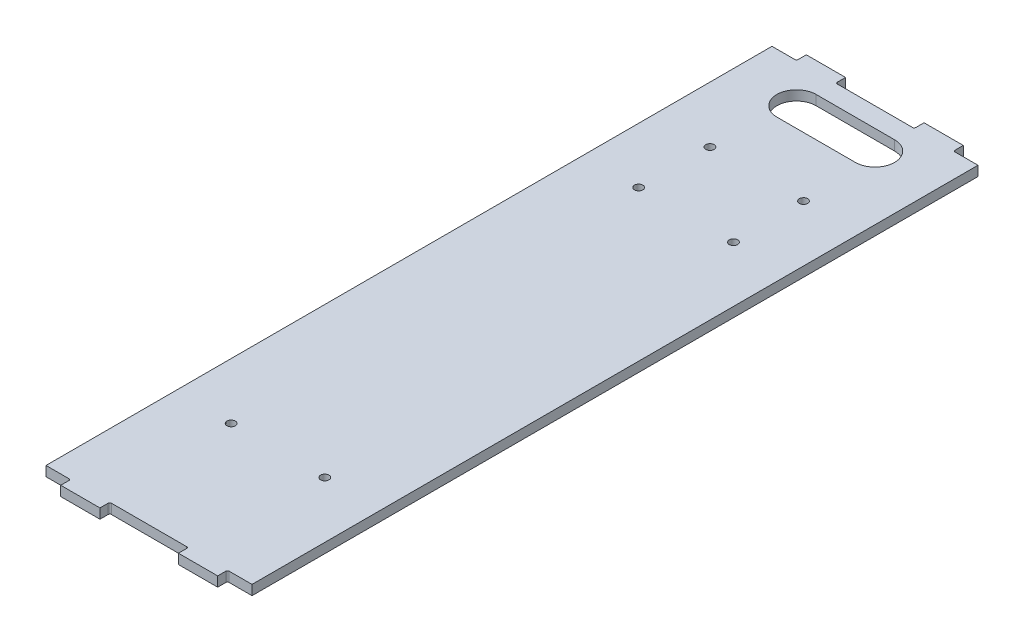
from build123d import *

# Parameters (mm, degrees)
SKETCH1_W             = 66.675
SKETCH1_H             = 234.95
BOSS_EXTRUDE1_DEPTH   = 3.175
SKETCH3_W             = 12.7
SKETCH3_H             = 3.175
BOSS_EXTRUDE2_DEPTH   = 3.175
CUT_EXTRUDE1_DEPTH    = 126.211389383
FILLET1_R             = 0.508
F_6_32_TAPPED_HOLE1_D = 2.7051


with BuildPart() as part:
    # Sketch1 → Boss-Extrude1 (new body)
    with BuildSketch(Plane(origin=(0, 0, 0), x_dir=(1, 0, 0), z_dir=(0, 1, 0))):
        Rectangle(SKETCH1_W, SKETCH1_H)
    extrude(amount=BOSS_EXTRUDE1_DEPTH)

    # Sketch3 → Boss-Extrude2 (add)
    with BuildSketch(Plane(origin=(0, 3.175, 0), x_dir=(1, 0, 0), z_dir=(0, 1, 0))):
        with Locations((-19.05, -119.0625)):
            Rectangle(SKETCH3_W, SKETCH3_H)
        with Locations((19.05, -119.0625)):
            Rectangle(SKETCH3_W, SKETCH3_H)
        with Locations((19.05, 119.0625)):
            Rectangle(SKETCH3_W, SKETCH3_H)
        with Locations((-19.05, 119.0625)):
            Rectangle(SKETCH3_W, SKETCH3_H)
    extrude(amount=-BOSS_EXTRUDE2_DEPTH)

    # Sketch4 → Cut-Extrude1 (cut, through all)
    with BuildSketch(Plane(origin=(0, 3.175, 0), x_dir=(1, 0, 0), z_dir=(0, 1, 0))):
        with BuildLine():
            Line((-12.7, 111.125), (12.7, 111.125))
            ThreePointArc((12.7, 111.125), (19.05, 104.775), (12.7, 98.425))
            Line((12.7, 98.425), (-12.7, 98.425))
            ThreePointArc((-12.7, 98.425), (-19.05, 104.775), (-12.7, 111.125))
        make_face()
    extrude(amount=-CUT_EXTRUDE1_DEPTH, mode=Mode.SUBTRACT)

    # Fillet1
    fillet1_edges = [part.edges().sort_by_distance(p)[0] for p in [
        (25.4, 1.5875, 117.475),
        (12.7, 1.5875, 117.475),
        (-12.7, 1.5875, 117.475),
        (-25.4, 1.5875, 117.475),
        (25.4, 1.5875, -117.475),
        (-12.7, 1.5875, -117.475),
        (-25.4, 1.5875, -117.475),
        (12.7, 1.5875, -117.475),
    ]]
    fillet(fillet1_edges, radius=FILLET1_R)

    # #6-32 Tapped Hole1 (through all)
    with Locations(Plane(origin=(-15.15, 3.175, -79.195), x_dir=(0, 0, 1), z_dir=(0, 1, 0))):
        with Locations((0, 0), (22.86, -0.18), (154.94, 0), (0, 30.3), (22.86, 30.48), (154.94, 30.3)):
            Hole(F_6_32_TAPPED_HOLE1_D / 2)


solid = part.part
